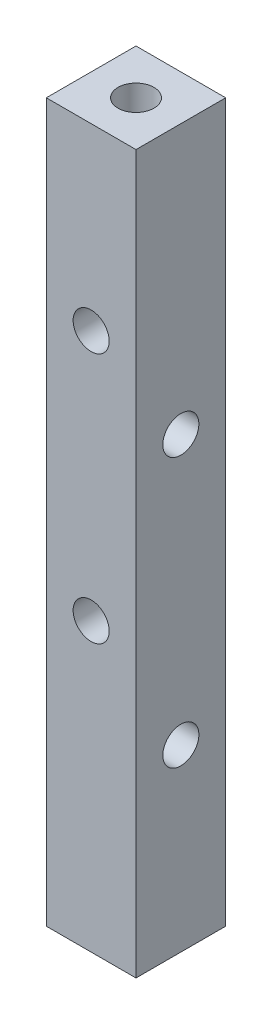
from build123d import *

# Parameters (mm, degrees)
SKETCH1_W                             = 12.7
SKETCH1_H                             = 12.7
BOSS_EXTRUDE1_DEPTH                   = 101.6
F_1_4_20_TAPPED_HOLE1_D               = 5.1054
F_1_4_20_TAPPED_HOLE1_DEPTH           = 16.51
F_1_4_20_TAPPED_HOLE1_TIP             = 1.533816902
F_1_4_20_TAPPED_HOLE1_ON_FACE_2_D     = 5.1054
F_1_4_20_TAPPED_HOLE1_ON_FACE_2_DEPTH = 16.51
F_1_4_20_TAPPED_HOLE1_ON_FACE_2_TIP   = 1.533816902
F_1_4_20_TAPPED_HOLE2_D               = 5.1054
F_1_4_20_TAPPED_HOLE2_DEPTH           = 16.51
F_1_4_20_TAPPED_HOLE2_TIP             = 1.533816902
F_1_4_20_TAPPED_HOLE3_D               = 5.1054
F_1_4_20_TAPPED_HOLE3_DEPTH           = 16.51
F_1_4_20_TAPPED_HOLE3_TIP             = 1.533816902


with BuildPart() as part:
    # Sketch1 → Boss-Extrude1 (new body)
    with BuildSketch(Plane(origin=(0, 0, 0), x_dir=(1, 0, 0), z_dir=(0, 1, 0))):
        with Locations((6.35, -6.35)):
            Rectangle(SKETCH1_W, SKETCH1_H)
    extrude(amount=BOSS_EXTRUDE1_DEPTH)

    # 1/4-20 Tapped Hole1
    with Locations(Plane(origin=(6.35, 0, 6.35), x_dir=(0, 0, -1), z_dir=(0, -1, 0))):
        with Locations((0, 0)):
            Hole(F_1_4_20_TAPPED_HOLE1_D / 2, depth=F_1_4_20_TAPPED_HOLE1_DEPTH)
            with Locations((0, 0, -(F_1_4_20_TAPPED_HOLE1_DEPTH + F_1_4_20_TAPPED_HOLE1_TIP / 2))):  # 118° drill point
                Cone(0, F_1_4_20_TAPPED_HOLE1_D / 2, F_1_4_20_TAPPED_HOLE1_TIP, mode=Mode.SUBTRACT)

    # 1/4-20 Tapped Hole1 on face 2
    with Locations(Plane(origin=(6.35, 101.6, 6.35), x_dir=(0, 0, 1), z_dir=(0, 1, 0))):
        with Locations((0, 0)):
            Hole(F_1_4_20_TAPPED_HOLE1_ON_FACE_2_D / 2, depth=F_1_4_20_TAPPED_HOLE1_ON_FACE_2_DEPTH)
            with Locations((0, 0, -(F_1_4_20_TAPPED_HOLE1_ON_FACE_2_DEPTH + F_1_4_20_TAPPED_HOLE1_ON_FACE_2_TIP / 2))):  # 118° drill point
                Cone(0, F_1_4_20_TAPPED_HOLE1_ON_FACE_2_D / 2, F_1_4_20_TAPPED_HOLE1_ON_FACE_2_TIP, mode=Mode.SUBTRACT)

    # 1/4-20 Tapped Hole2
    with Locations(Plane(origin=(6.35, 76.2, 0), x_dir=(-1, 0, 0), z_dir=(0, 0, -1))):
        with Locations((0, 0), (0, -35.56)):
            Hole(F_1_4_20_TAPPED_HOLE2_D / 2, depth=F_1_4_20_TAPPED_HOLE2_DEPTH)
            with Locations((0, 0, -(F_1_4_20_TAPPED_HOLE2_DEPTH + F_1_4_20_TAPPED_HOLE2_TIP / 2))):  # 118° drill point
                Cone(0, F_1_4_20_TAPPED_HOLE2_D / 2, F_1_4_20_TAPPED_HOLE2_TIP, mode=Mode.SUBTRACT)

    # 1/4-20 Tapped Hole3
    with Locations(Plane(origin=(12.7, 25.4, 6.35), x_dir=(0, 0, 1), z_dir=(1, 0, 0))):
        with Locations((0, 0), (0, -38.1)):
            Hole(F_1_4_20_TAPPED_HOLE3_D / 2, depth=F_1_4_20_TAPPED_HOLE3_DEPTH)
            with Locations((0, 0, -(F_1_4_20_TAPPED_HOLE3_DEPTH + F_1_4_20_TAPPED_HOLE3_TIP / 2))):  # 118° drill point
                Cone(0, F_1_4_20_TAPPED_HOLE3_D / 2, F_1_4_20_TAPPED_HOLE3_TIP, mode=Mode.SUBTRACT)


solid = part.part
